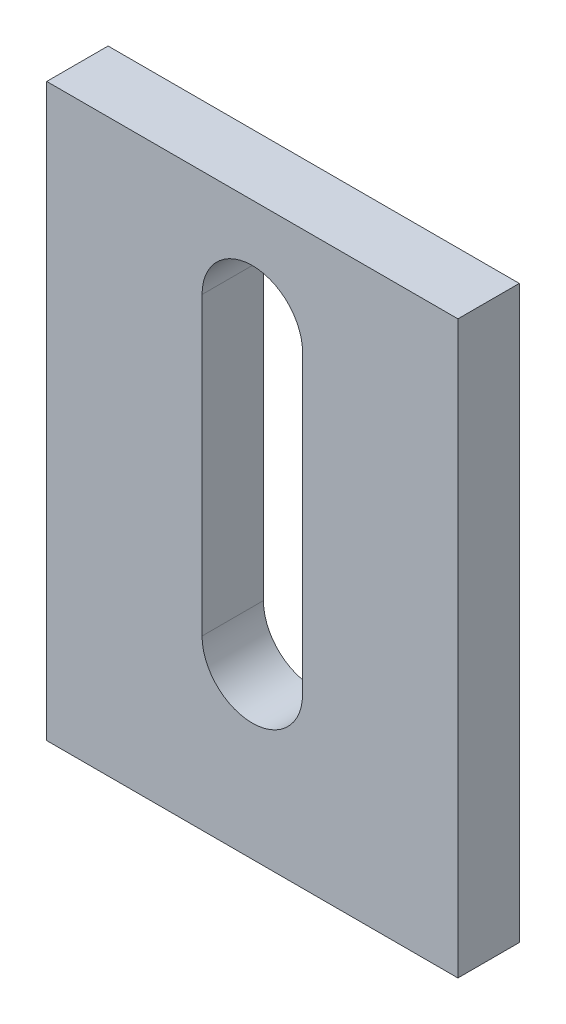
from build123d import *

# Parameters (mm, degrees)
EXTRUDE_1_DEPTH = 4.3


with BuildPart() as part:
    # 草图1 → 凸台-拉伸1 (new body)
    with BuildSketch(Plane.XY):
        Polygon((31.812419505, -35.7), (31.812419505, -40), (3, -40), (3, -35.7), (3, 0), (31.812419505, 0), align=None)
        with BuildLine():
            Line((20.928372126, -7.487592169), (20.928372126, -28.212407831))
            ThreePointArc((20.928372126, -28.212407831), (17.406209752, -31.734570205), (13.884047379, -28.212407831))
            Line((13.884047379, -28.212407831), (13.884047379, -7.487592169))
            ThreePointArc((13.884047379, -7.487592169), (17.406209752, -3.965429795), (20.928372126, -7.487592169))
        make_face(mode=Mode.SUBTRACT)
    extrude(amount=EXTRUDE_1_DEPTH)


solid = part.part
